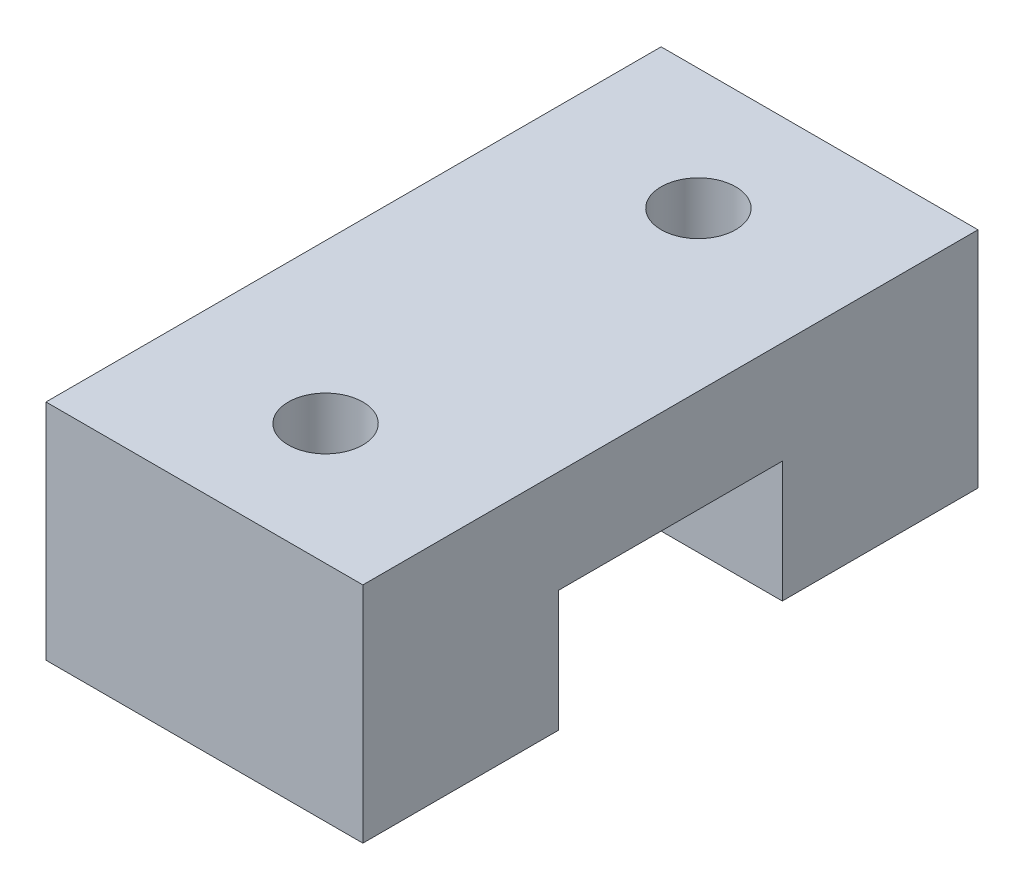
from build123d import *

# Parameters (mm, degrees)
CROQUIS1_W              = 17
CROQUIS1_H              = 33
SALIENTE_EXTRUIR1_DEPTH = 12
CROQUIS2_R              = 2
CORTAR_EXTRUIR1_DEPTH   = 23.102036105
CROQUIS3_W              = 12
CROQUIS3_H              = 6.5
CORTAR_EXTRUIR2_DEPTH   = 27.55654345


with BuildPart() as part:
    # Croquis1 → Saliente-Extruir1 (new body)
    with BuildSketch(Plane(origin=(0, 0, 0), x_dir=(1, 0, 0), z_dir=(0, 1, 0))):
        Rectangle(CROQUIS1_W, CROQUIS1_H)
    extrude(amount=SALIENTE_EXTRUIR1_DEPTH)

    # Croquis2 → Cortar-Extruir1 (cut, through all)
    with BuildSketch(Plane(origin=(0, 12, 0), x_dir=(1, 0, 0), z_dir=(0, 1, 0))):
        with Locations(Location((0, 10, 0), (0, 0, 270))):
            Circle(CROQUIS2_R)
        with Locations(Location((0, -10, 0), (0, 0, 90))):
            Circle(CROQUIS2_R)
    extrude(amount=-CORTAR_EXTRUIR1_DEPTH, mode=Mode.SUBTRACT)

    # Croquis3 → Cortar-Extruir2 (cut, through all)
    with BuildSketch(Plane(origin=(8.5, 0, 0), x_dir=(0, 0, -1), z_dir=(1, 0, 0))):
        with Locations((0, 3.25)):
            Rectangle(CROQUIS3_W, CROQUIS3_H)
    extrude(amount=-CORTAR_EXTRUIR2_DEPTH, mode=Mode.SUBTRACT)


solid = part.part
